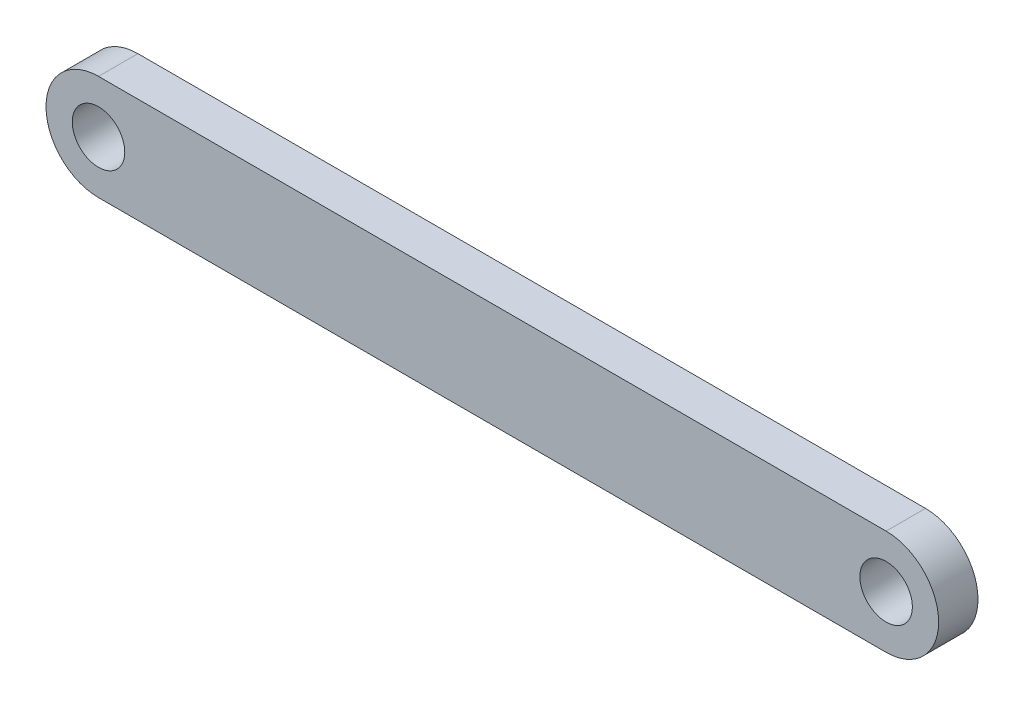
from build123d import *

# Parameters (mm, degrees)
SKETCH_1_R      = 1
EXTRUDE_1_DEPTH = 1.5


with BuildPart() as part:
    # 草图1 → 凸台-拉伸1 (new body)
    with BuildSketch(Plane.XY):
        with BuildLine():
            Line((0, 2), (30, 2))
            ThreePointArc((30, 2), (32, 0), (30, -2))
            Line((30, -2), (0, -2))
            ThreePointArc((0, -2), (-2, 0), (0, 2))
        make_face()
        with Locations((30, 0)):
            Circle(SKETCH_1_R, mode=Mode.SUBTRACT)
        Circle(SKETCH_1_R, mode=Mode.SUBTRACT)
    extrude(amount=EXTRUDE_1_DEPTH)


solid = part.part
